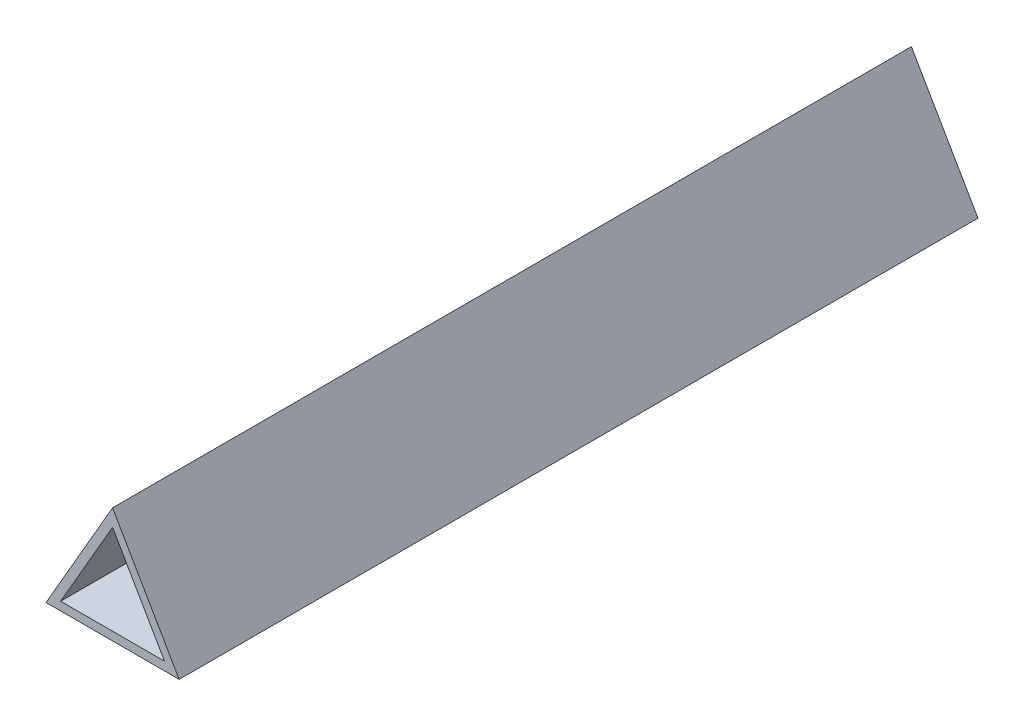
from build123d import *

# Parameters (mm, degrees)
BOSS_EXTRUDE1_DEPTH = 300


with BuildPart() as part:
    # Sketch1 → Boss-Extrude1 (new body)
    with BuildSketch(Plane.XY):
        Polygon((0, 0), (25, 43.301270189), (50, 0), align=None)
        Polygon((25, 36.951270189), (5.499261314, 3.175), (44.500738686, 3.175), align=None, mode=Mode.SUBTRACT)
    extrude(amount=BOSS_EXTRUDE1_DEPTH)


solid = part.part
